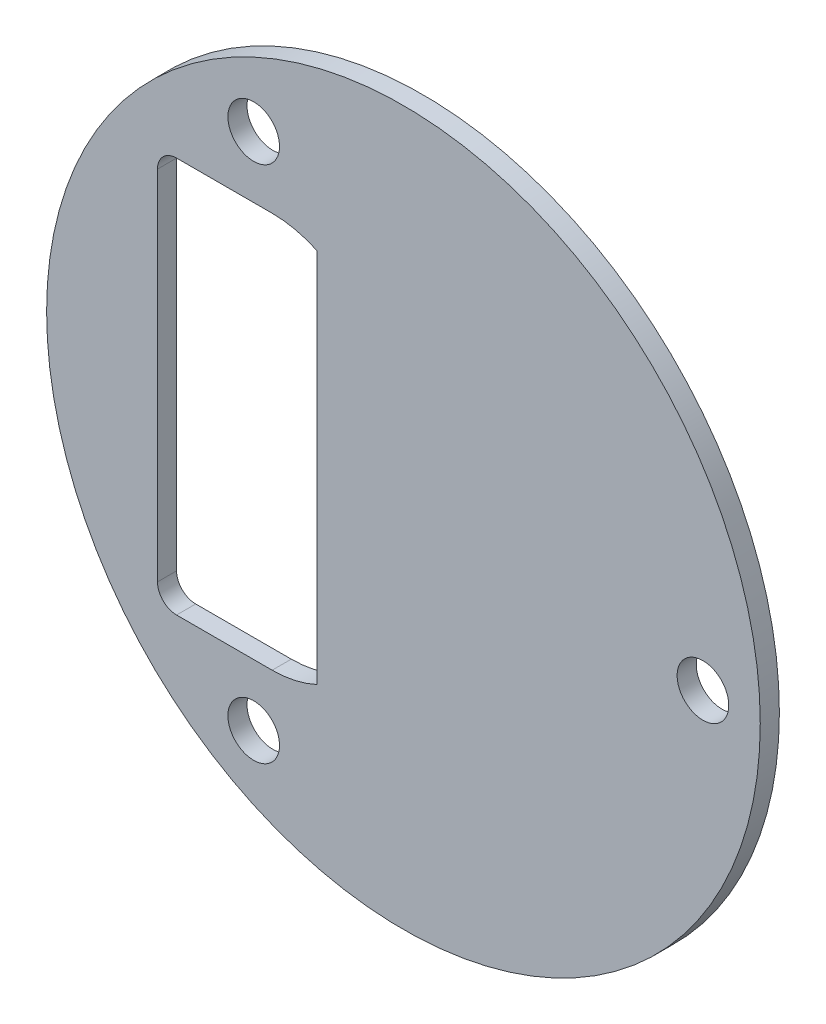
from build123d import *

# Parameters (mm, degrees)
SKETCH1_R           = 56
SKETCH1_R_2         = 4.05
BOSS_EXTRUDE1_DEPTH = 3


with BuildPart() as part:
    # Sketch1 → Boss-Extrude1 (new body)
    with BuildSketch(Plane.XY):
        Circle(SKETCH1_R)
        with Locations((-23.5, 40.703193978)):
            Circle(SKETCH1_R_2, mode=Mode.SUBTRACT)
        with Locations((-23.5, -40.703193978)):
            Circle(SKETCH1_R_2, mode=Mode.SUBTRACT)
        with Locations((47, 0)):
            Circle(SKETCH1_R_2, mode=Mode.SUBTRACT)
        with BuildLine():
            Line((-20.603621104, 31.05), (-35.603621104, 31.05))
            ThreePointArc((-35.603621104, 31.05), (-37.724941448, 30.171320344), (-38.603621104, 28.05))
            Line((-38.603621104, 28.05), (-38.603621104, 2.45))
            Line((-38.603621104, 2.45), (-38.603621104, -28.05))
            ThreePointArc((-38.603621104, -28.05), (-37.724941448, -30.171320344), (-35.603621104, -31.05))
            Line((-35.603621104, -31.05), (-20.603621104, -31.05))
            ThreePointArc((-20.603621104, -31.05), (-17.018844263, -30.657863153), (-13.603621104, -29.5))
            Line((-13.603621104, -29.5), (-13.603621104, 29.5))
            ThreePointArc((-13.603621104, 29.5), (-17.018844263, 30.657863153), (-20.603621104, 31.05))
        make_face(mode=Mode.SUBTRACT)
    extrude(amount=BOSS_EXTRUDE1_DEPTH)


solid = part.part
